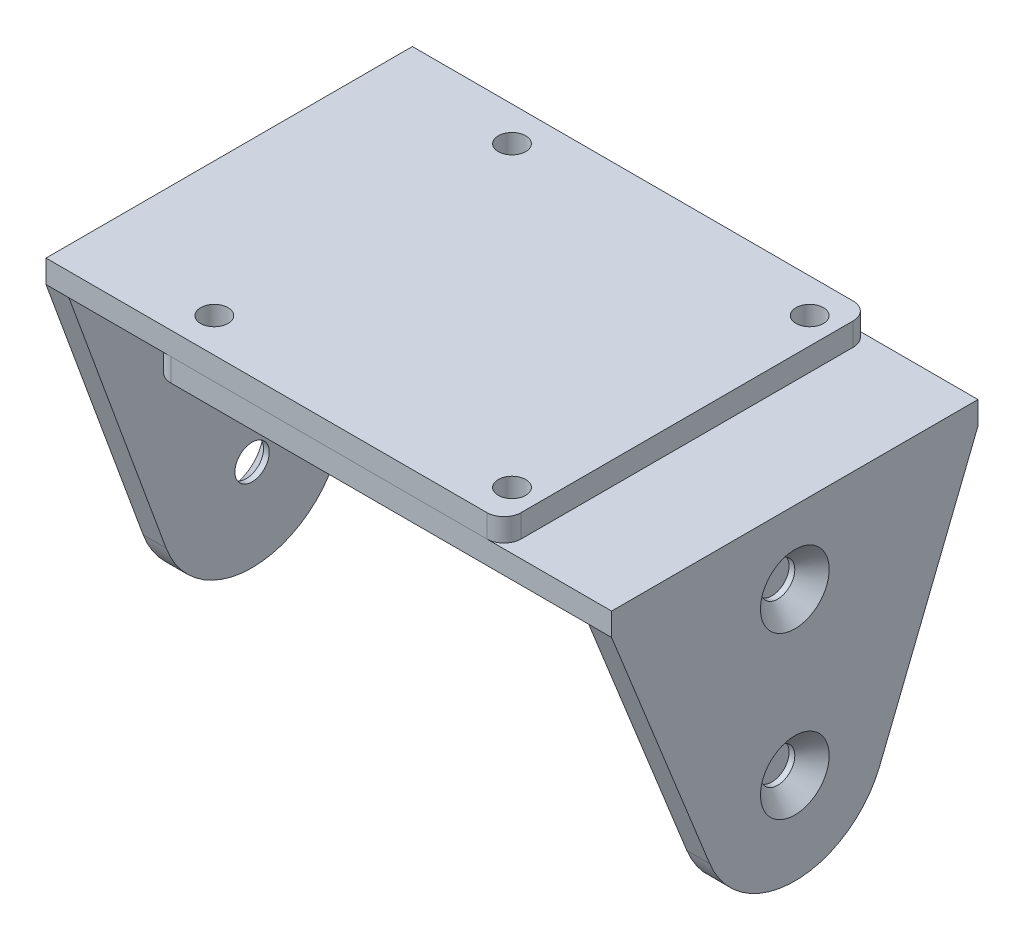
from build123d import *

# Parameters (mm, degrees)
SKETCH_1_W        = 40
SKETCH_1_H        = 32
SKETCH_1_R        = 1.2
EXTRUDE_1_DEPTH   = 2
SKETCH_2_W        = 40
SKETCH_2_H        = 32
SKETCH_2_R        = 1.2
EXTRUDE_2_DEPTH   = 2
SKETCH_3_R        = 1.5
EXTRUDE_1_2_DEPTH = 2
EXTRUDE_START     = -2
SKETCH_4_R        = 1.5
EXTRUDE_2_2_DEPTH = 2
FILLET_1_R        = 1.5
FILLET_2_R        = 1.5
CHAMFER_1_SIZE    = 1.5
CHAMFER_2_SIZE    = 1.5
EXTRUDE_5_DEPTH   = 2.6
SKETCH_6_R        = 4.85
EXTRUDE_6_DEPTH   = 1.6
CHAMFER_3_SIZE    = 1.4


with BuildPart() as part:
    # Эскиз1 → Extrude 1 (new body)
    with BuildSketch(Plane(origin=(0, 0, 0), x_dir=(1, 0, 0), z_dir=(0, 1, 0))):
        with Locations((20, 0)):
            Rectangle(SKETCH_1_W, SKETCH_1_H)
        with Locations((11.7, 13)):
            Circle(SKETCH_1_R, mode=Mode.SUBTRACT)
        with Locations((37.7, 13)):
            Circle(SKETCH_1_R, mode=Mode.SUBTRACT)
        with Locations((37.7, -13)):
            Circle(SKETCH_1_R, mode=Mode.SUBTRACT)
        with Locations((11.7, -13)):
            Circle(SKETCH_1_R, mode=Mode.SUBTRACT)
    extrude(amount=EXTRUDE_1_DEPTH)

    # Эскиз3 → Extrude 1 2 (add)
    with BuildSketch(Plane.ZY):
        with BuildLine():
            Line((-16, 0), (-7.512179228, -23.179047732))
            ThreePointArc((-7.512179228, -23.179047732), (0, -28.4282), (7.512179228, -23.179047732))
            Line((7.512179228, -23.179047732), (16, 0))
            Line((16, 0), (-16, 0))
        make_face()
        with Locations((0, -20.4282)):
            Circle(SKETCH_3_R, mode=Mode.SUBTRACT)
    extrude(amount=-EXTRUDE_1_2_DEPTH)

    # Скругление2
    fillet_2_edges = [part.edges().sort_by_distance(p)[0] for p in [
        (40, 1, -16),
        (40, 1, 16),
    ]]
    fillet(fillet_2_edges, radius=FILLET_2_R)

    # Фаска2
    chamfer_2_edges = [part.edges().sort_by_distance(p)[0] for p in [
        (0, -20.4282, -1.5),
    ]]
    chamfer(chamfer_2_edges, length=CHAMFER_2_SIZE)


with BuildPart() as body_2:
    # Эскиз2 → Extrude 2 (new body)
    with BuildSketch(Plane(origin=(0, 0, 0), x_dir=(1, 0, 0), z_dir=(0, 1, 0))):
        with Locations((29.4, 0)):
            Rectangle(SKETCH_2_W, SKETCH_2_H)
        with Locations((11.7, 13)):
            Circle(SKETCH_2_R, mode=Mode.SUBTRACT)
        with Locations((37.7, 13)):
            Circle(SKETCH_2_R, mode=Mode.SUBTRACT)
        with Locations((37.7, -13)):
            Circle(SKETCH_2_R, mode=Mode.SUBTRACT)
        with Locations((11.7, -13)):
            Circle(SKETCH_2_R, mode=Mode.SUBTRACT)
    extrude(amount=-EXTRUDE_2_DEPTH)

    # Эскиз4 → Extrude 2 2 (add)
    with BuildSketch(Plane(origin=(49.4, 0, 0), x_dir=(0, 0, -1), z_dir=(1, 0, 0)).offset(EXTRUDE_START)):
        with BuildLine():
            Line((16, -2), (7.426322109, -23.403051246))
            ThreePointArc((7.426322109, -23.403051246), (0, -28.4282), (-7.426322109, -23.403051246))
            Line((-7.426322109, -23.403051246), (-16, -2))
            Line((-16, -2), (16, -2))
        make_face()
        with Locations((0, -20.4282)):
            Circle(SKETCH_4_R, mode=Mode.SUBTRACT)
        with Locations((0, -6.35)):
            Circle(SKETCH_4_R, mode=Mode.SUBTRACT)
    extrude(amount=EXTRUDE_2_2_DEPTH)

    # Скругление1
    fillet_1_edges = [body_2.edges().sort_by_distance(p)[0] for p in [
        (9.4, -1, 16),
        (9.4, -1, -16),
    ]]
    fillet(fillet_1_edges, radius=FILLET_1_R)

    # Фаска1
    chamfer_1_edges = [body_2.edges().sort_by_distance(p)[0] for p in [
        (49.4, -20.4282, 1.5),
        (49.4, -6.35, 1.5),
    ]]
    chamfer(chamfer_1_edges, length=CHAMFER_1_SIZE)


with BuildPart() as body_3:
    # Эскиз5 → Бобышка-Вытянуть5 (new body)
    with BuildSketch(Plane.ZY.offset(-47.4)):
        with BuildLine():
            Line((4.9, -2.3782), (-4.9, -2.3782))
            Line((-4.9, -2.3782), (-6.425600177, -19.867698109))
            ThreePointArc((-6.425600177, -19.867698109), (0, -26.8782), (6.425600177, -19.867698109))
            Line((6.425600177, -19.867698109), (4.9, -2.3782))
        make_face()
    extrude(amount=EXTRUDE_5_DEPTH)


with BuildPart() as body_4:
    # Эскиз6 → Бобышка-Вытянуть6 (new body)
    with BuildSketch(Plane.ZY.offset(-44.8)):
        with Locations((0, -20.4282)):
            Circle(SKETCH_6_R)
    extrude(amount=EXTRUDE_6_DEPTH)

    # Фаска3
    chamfer_3_edges = [body_4.edges().sort_by_distance(p)[0] for p in [
        (43.2, -20.4282, -4.85),
    ]]
    chamfer(chamfer_3_edges, length=CHAMFER_3_SIZE)


solid = Compound([part.part, body_2.part, body_3.part, body_4.part])
